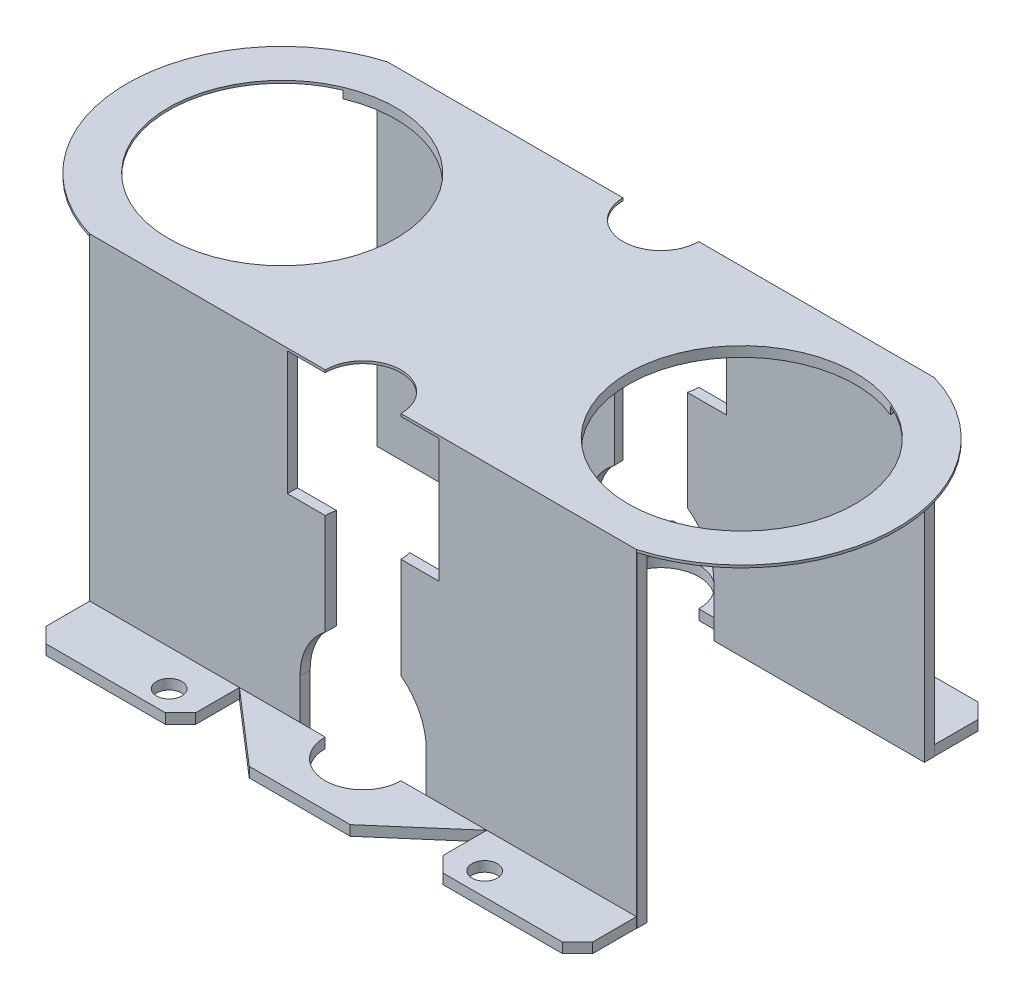
from build123d import *
from build123d.topology import SkipClean

# Parameters (mm, degrees)
SKETCH1_W               = 300
SKETCH1_H               = 245
BOSS_EXTRUDE1_DEPTH     = 590
SKETCH2_R               = 25
BOSS_EXTRUDE2_DEPTH     = 650
SKETCH2_4_R             = 225
CUT_EXTRUDE2_DEPTH      = 1236.329432749
CUT_EXTRUDE4_DEPTH      = 1624.31086661
CUT_EXTRUDE4_DEPTH_BACK = 1624.31086661
SKETCH3_W               = 274.95540651
SKETCH3_H               = 630
SKETCH3_W_2             = 550
SKETCH3_H_2             = 742.404091098
SKETCH3_W_3             = 176.90498613


with BuildPart() as part:
    # Sketch1 → Boss-Extrude1 (new body)
    with BuildSketch(Plane.XY):
        with BuildLine():
            Line((-542, 645), (-542, 0))
            Line((-542, 0), (-125, 0))
            Line((-125, 0), (-125, 99.927755898))
            ThreePointArc((-125, 99.927755898), (0, 224.927755898), (125, 99.927755898))
            Line((125, 99.927755898), (125, 0))
            Line((125, 0), (542, 0))
            Line((542, 0), (542, 645))
            Line((542, 645), (769.142885948, 645))
            Line((769.142885948, 645), (769.142885948, 650))
            Line((769.142885948, 650), (-769.142885948, 650))
            Line((-769.142885948, 650), (-769.142885948, 645))
            Line((-769.142885948, 645), (-542, 645))
        make_face()
        with Locations((0, 522.5)):
            Rectangle(SKETCH1_W, SKETCH1_H, mode=Mode.SUBTRACT)
    extrude(amount=BOSS_EXTRUDE1_DEPTH)

    # Sketch2 → Boss-Extrude2 (add)
    # profile 1 of 6: a face of its own
    with BuildSketch(Plane(origin=(0, 650, 0), x_dir=(1, 0, 0), z_dir=(0, 1, 0))):
        Polygon((-541.5, 86.663012773), (-541.5, 0), (-244.996182612, 0), (-244.996182612, 86.663012773), (-274.996182612, 116.663012773), (-511.5, 116.663012773), align=None)
        with Locations((-312.5, 71.663012773)):
            Circle(SKETCH2_R, mode=Mode.SUBTRACT)
    # profile 2 of 6: a face of its own
    with BuildSketch(Plane(origin=(0, 650, 0), x_dir=(1, 0, 0), z_dir=(0, 1, 0))):
        with BuildLine():
            Line((-100, 125.512423659), (-244.996182612, 0))
            Line((-244.996182612, 0), (-75, 0))
            ThreePointArc((-75, 0), (0, 75), (75, 0))
            Line((75, 0), (244.996182612, 0))
            Line((244.996182612, 0), (100, 125.512423659))
            Line((100, 125.512423659), (-100, 125.512423659))
        make_face()
    # profile 3 of 6: a face of its own
    with BuildSketch(Plane(origin=(0, 650, 0), x_dir=(1, 0, 0), z_dir=(0, 1, 0))):
        Polygon((-244.996182612, -590), (-541.5, -590), (-541.5, -676.663012773), (-511.5, -706.663012773), (-274.996182612, -706.663012773), (-244.996182612, -676.663012773), align=None)
        with Locations((-312.5, -661.663012773)):
            Circle(SKETCH2_R, mode=Mode.SUBTRACT)
    # profile 4 of 6: a face of its own
    with BuildSketch(Plane(origin=(0, 650, 0), x_dir=(1, 0, 0), z_dir=(0, 1, 0))):
        with BuildLine():
            Line((-75, -590), (-244.996182612, -590))
            Line((-244.996182612, -590), (-100, -715.512423659))
            Line((-100, -715.512423659), (100, -715.512423659))
            Line((100, -715.512423659), (244.996182612, -590))
            Line((244.996182612, -590), (75, -590))
            ThreePointArc((75, -590), (0, -665), (-75, -590))
        make_face()
    # profile 5 of 6: a face of its own
    with BuildSketch(Plane(origin=(0, 650, 0), x_dir=(1, 0, 0), z_dir=(0, 1, 0))):
        Polygon((244.996182612, 86.663012773), (244.996182612, 0), (541.5, 0), (541.5, 86.663012773), (511.5, 116.663012773), (274.996182612, 116.663012773), align=None)
        with Locations((312.5, 71.663012773)):
            Circle(SKETCH2_R, mode=Mode.SUBTRACT)
    # profile 6 of 6: a face of its own
    with BuildSketch(Plane(origin=(0, 650, 0), x_dir=(1, 0, 0), z_dir=(0, 1, 0))):
        Polygon((541.5, -590), (244.996182612, -590), (244.996182612, -676.663012773), (274.996182612, -706.663012773), (511.5, -706.663012773), (541.5, -676.663012773), align=None)
        with Locations((312.5, -661.663012773)):
            Circle(SKETCH2_R, mode=Mode.SUBTRACT)
    extrude(amount=-BOSS_EXTRUDE2_DEPTH)

    # Sketch2<4> → Cut-Extrude2 (cut, through all)
    with SkipClean():  # the faces are left unmerged after this step: merging them gives an invalid solid
        with BuildSketch(Plane(origin=(0, 650, 0), x_dir=(1, 0, 0), z_dir=(0, 1, 0))):
            with BuildLine():
                ThreePointArc((-541.5, -590), (-762.601277219, -295), (-541.5, 0))
                Line((-541.5, 0), (-769.142885948, 0))
                Line((-769.142885948, 0), (-769.142885948, -590))
                Line((-769.142885948, -590), (-541.5, -590))
            make_face()
            with BuildLine():
                Line((75, 0), (-75, 0))
                ThreePointArc((-75, 0), (0, -75), (75, 0))
            make_face()
            with BuildLine():
                ThreePointArc((75, -590), (0, -515), (-75, -590))
                Line((-75, -590), (75, -590))
            make_face()
            with BuildLine():
                Line((769.142885948, 0), (541.5, 0))
                ThreePointArc((541.5, 0), (762.601277219, -295), (541.5, -590))
                Line((541.5, -590), (769.142885948, -590))
                Line((769.142885948, -590), (769.142885948, 0))
            make_face()
            with Locations((-455.251684993, -295)):
                Circle(SKETCH2_4_R)
            with Locations((455.251684993, -295)):
                Circle(SKETCH2_4_R)
        extrude(amount=-CUT_EXTRUDE2_DEPTH, mode=Mode.SUBTRACT)

    # Sketch3 → Cut-Extrude4 (cut, two sides: drawn at the far end of the back side and taken through both)
    with BuildSketch(Plane(origin=(541.5, 0, 0), x_dir=(0, 0, -1), z_dir=(1, 0, 0)).offset(-CUT_EXTRUDE4_DEPTH_BACK)):
        with Locations((-727.477703255, 335)):
            Rectangle(SKETCH3_W, SKETCH3_H)
        with Locations((-295, 258.797954451)):
            Rectangle(SKETCH3_W_2, SKETCH3_H_2)
        with Locations((88.452493065, 335)):
            Rectangle(SKETCH3_W_3, SKETCH3_H)
    extrude(amount=CUT_EXTRUDE4_DEPTH + CUT_EXTRUDE4_DEPTH_BACK, mode=Mode.SUBTRACT)


solid = part.part
